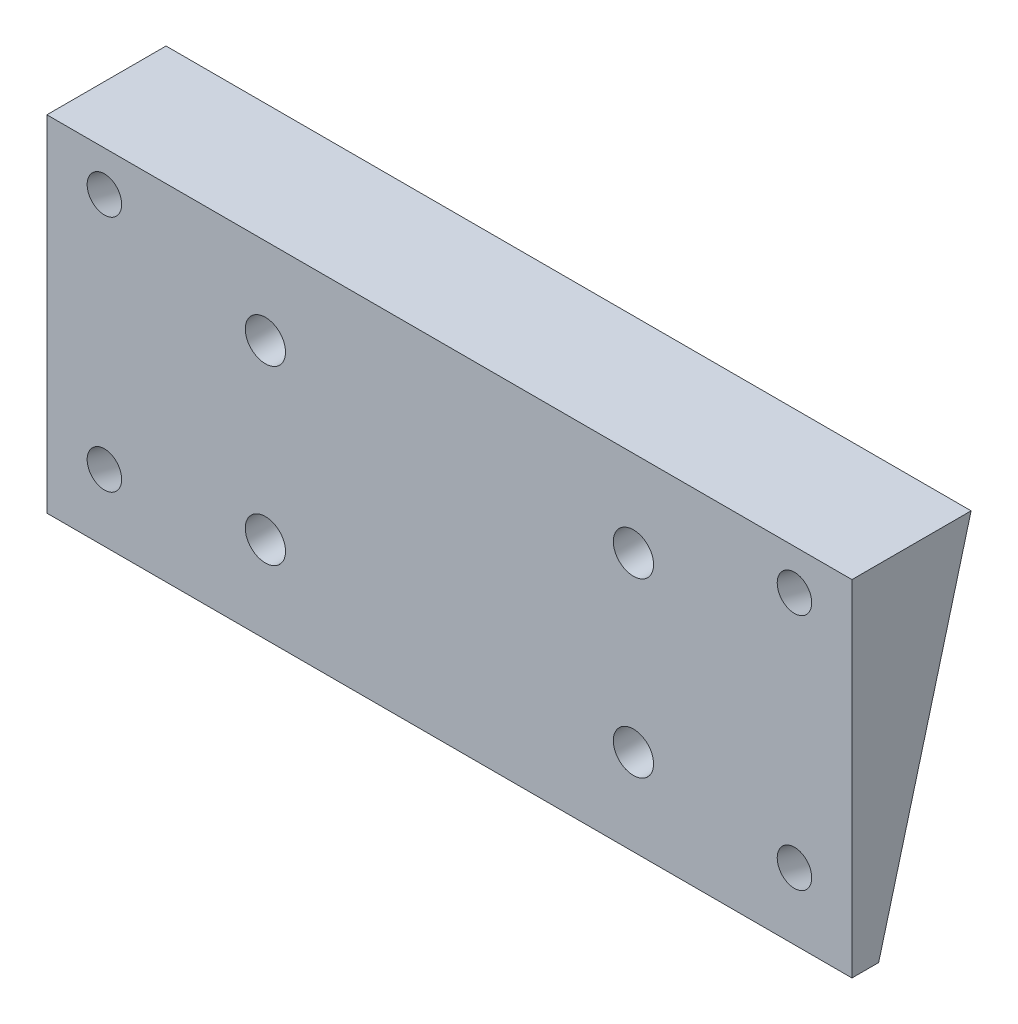
from build123d import *

# Parameters (mm, degrees)
EXTRUDE_1_DEPTH     = 40
EXTRUDE_2_DEPTH     = 40
SKETCH_9_W          = 20.5
SKETCH_9_H          = 20
CUT_EXTRUDE_2_DEPTH = 20
SKETCH_10_W         = 4.875
SKETCH_10_H         = 20
CUT_EXTRUDE_3_DEPTH = 20
CUT_EXTRUDE_4_DEPTH = 55
SKETCH_12_W         = 51.656841865
SKETCH_12_H         = 34.217395835
CUT_EXTRUDE_5_DEPTH = 34
EXTRUDE_3_DEPTH     = 40
SKETCH_16_R         = 1.75
CUT_EXTRUDE_6_DEPTH = 10
EXTRUDE_4_DEPTH     = 15
EXTRUDE_5_DEPTH     = 15
SKETCH_19_R         = 1.5
CUT_EXTRUDE_7_DEPTH = 10


with BuildPart() as part:
    # 草图1 → 凸台-拉伸1 (new body)
    with BuildSketch(Plane.XY):
        Polygon((74.641016151, 0), (74.641016151, 20), (34.641016151, 20), (34.641016151, 9.282032303), (34.641016151, 0), align=None)
    extrude(amount=EXTRUDE_1_DEPTH)

    # 草图8 → 凸台-拉伸2 (add)
    with BuildSketch(Plane(origin=(74.641016151, 0, 0), x_dir=(0, 0, -1), z_dir=(1, 0, 0))):
        Polygon((0, 0), (0, 20), (5.358983849, 20), align=None)
    extrude(amount=-EXTRUDE_2_DEPTH)

    # 草图9 → 切除-拉伸2 (cut)
    with BuildSketch(Plane.XY.offset(40)):
        with Locations((54.641016151, 10)):
            Rectangle(SKETCH_9_W, SKETCH_9_H)
    extrude(amount=-CUT_EXTRUDE_2_DEPTH, mode=Mode.SUBTRACT)

    # 草图10 → 切除-拉伸3 (cut)
    with BuildSketch(Plane.XY.offset(40)):
        with Locations((72.203516151, 10)):
            Rectangle(SKETCH_10_W, SKETCH_10_H)
        with Locations((37.078516151, 10)):
            Rectangle(SKETCH_10_W, SKETCH_10_H)
    extrude(amount=-CUT_EXTRUDE_3_DEPTH, mode=Mode.SUBTRACT)

    # 草图11 → 切除-拉伸4 (cut)
    with BuildSketch(Plane(origin=(74.641016151, 0, 0), x_dir=(0, 0, -1), z_dir=(1, 0, 0))):
        Polygon((0, 0), (5.358983849, 20), (-9.641016151, 20), (-15, 0), align=None)
    extrude(amount=-CUT_EXTRUDE_4_DEPTH, mode=Mode.SUBTRACT)

    # 草图12 → 切除-拉伸5 (cut)
    with BuildSketch(Plane.XY.offset(20)):
        with Locations((55.994076619, 8.947658785)):
            Rectangle(SKETCH_12_W, SKETCH_12_H)
    extrude(amount=CUT_EXTRUDE_5_DEPTH, mode=Mode.SUBTRACT)

    # 草图15 → 凸台-拉伸3 (add)
    with BuildSketch(Plane.ZY.offset(-34.641016151)):
        Polygon((20, 0), (20, -10), (17.679491924, -10), (15, 0), align=None)
    extrude(amount=-EXTRUDE_3_DEPTH)

    # 草图16 → 切除-拉伸6 (cut)
    with BuildSketch(Plane.XY.offset(20)):
        with Locations((38.641016151, 12.5)):
            Circle(SKETCH_16_R)
        with Locations((70.641016151, 12.5)):
            Circle(SKETCH_16_R)
        with Locations((70.641016151, -2.5)):
            Circle(SKETCH_16_R)
        with Locations((38.641016151, -2.5)):
            Circle(SKETCH_16_R)
    extrude(amount=-CUT_EXTRUDE_6_DEPTH, mode=Mode.SUBTRACT)

    # 草图17 → 凸台-拉伸4 (add)
    with BuildSketch(Plane(origin=(74.641016151, 0, 0), x_dir=(0, 0, -1), z_dir=(1, 0, 0))):
        Polygon((-20, 20), (-20, -10), (-17.679491924, -10), (-9.641016151, 20), align=None)
    extrude(amount=EXTRUDE_4_DEPTH)

    # 草图18 → 凸台-拉伸5 (add)
    with BuildSketch(Plane.ZY.offset(-34.641016151)):
        Polygon((20, 20), (9.641016151, 20), (17.679491924, -10), (20, -10), align=None)
    extrude(amount=EXTRUDE_5_DEPTH)

    # 草图19 → 切除-拉伸7 (cut)
    with BuildSketch(Plane(origin=(0, 3.75, 13.995190528), x_dir=(-1, 0, 0), z_dir=(0, -0.2588190451025213, -0.9659258262890682))):
        with Locations(Location((-84.641016151, -9.235047481, 0), (0, 0, 90))):
            Circle(SKETCH_19_R)
        with Locations(Location((-84.641016151, 10.764952519, 0), (0, 0, 90))):
            Circle(SKETCH_19_R)
        with Locations(Location((-24.641016151, -9.235047481, 0), (0, 0, 90))):
            Circle(SKETCH_19_R)
        with Locations(Location((-24.641016151, 10.764952519, 0), (0, 0, 90))):
            Circle(SKETCH_19_R)
    extrude(amount=-CUT_EXTRUDE_7_DEPTH, mode=Mode.SUBTRACT)


solid = part.part
